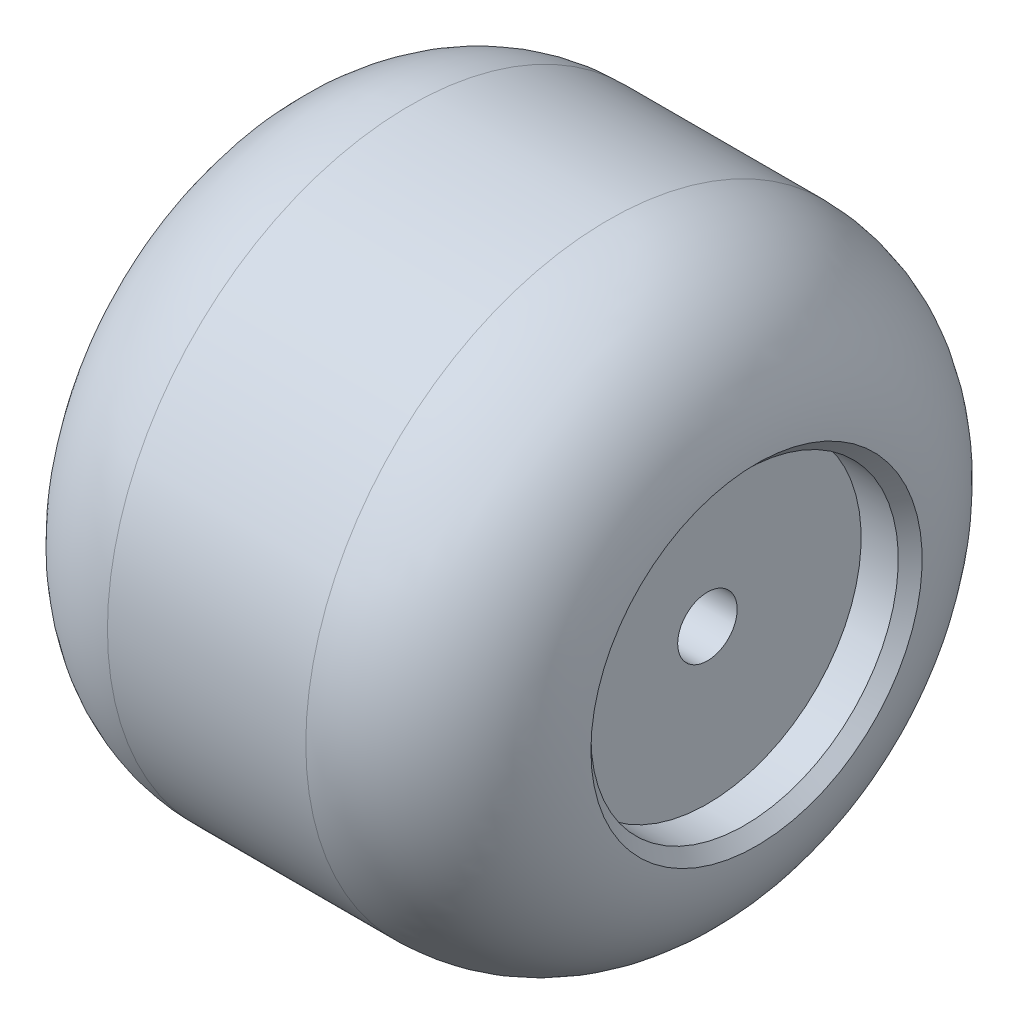
from build123d import *


with BuildPart() as part:
    # Sketch1 → Revolve1 (revolve)
    with BuildSketch(Plane(origin=(0, 0, 0), x_dir=(1, 0, 0), z_dir=(0, 1, 0)), mode=Mode.PRIVATE) as revolve1_sk:
        with BuildLine():
            Line((19.5, 6.2), (19.980711996, 6.680711996))
            ThreePointArc((19.980711996, 6.680711996), (18.069135536, 10.609323756), (14, 12.2))
            Line((14, 12.2), (6, 12.2))
            ThreePointArc((6, 12.2), (1.757359313, 10.442640687), (0, 6.2))
            Line((0, 6.2), (0, 1.2))
            Line((0, 1.2), (18, 1.2))
            Line((18, 1.2), (18, 6.2))
            Line((18, 6.2), (19.5, 6.2))
        make_face()
    revolve(revolve1_sk.sketch.rotate(Axis((0, 0, 0), (1, 0, 0)), 180), axis=Axis((0, 0, 0), (1, 0, 0)))


solid = part.part
